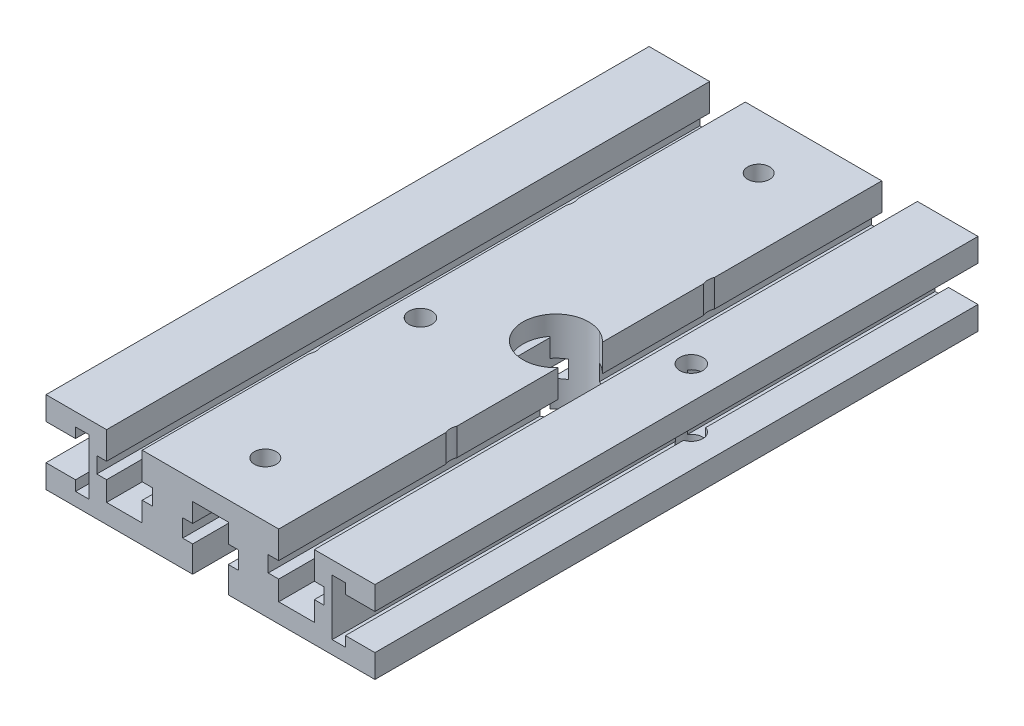
from build123d import *

# Parameters (mm, degrees)
EXTRUDE_1_DEPTH         = 110
HOLE_WIZARD_5_5_5_5_1_D = 5.5
HOLE_WIZARD_4_0_4_1_D   = 4
HOLE_WIZARD_12_0_12_1_D = 12
HOLE_WIZARD_M5_1_D      = 4.2


with BuildPart() as part:
    # 草图1 → 凸台-拉伸1 (new body)
    with BuildSketch(Plane.XY):
        Polygon((0, 0), (26.75, 0), (26.75, 4.796419132), (24.926505169, 4.796419132), (24.926505169, 8.023402897), (26.75, 8.023402897), (26.75, 11.5), (30, 11.5), (33.25, 11.5), (33.25, 8.023402897), (35.073494831, 8.023402897), (35.073494831, 4.796419132), (33.25, 4.796419132), (33.25, 0), (60, 0), (60, 4.25), (54.613325713, 4.25), (54.613325713, 2.4), (52.2, 2.4), (52.2, 12.6), (54.613325713, 12.6), (54.613325713, 10.75), (60, 10.75), (60, 15), (48.947608979, 15), (48.947608979, 10.003848618), (50.733802833, 10.003848618), (50.733802833, 7.094693738), (48.947608979, 7.094693738), (48.947608979, 3.5), (42.447608979, 3.5), (42.447608979, 7.094693738), (40.533802833, 7.094693738), (40.533802833, 10.003848618), (42.447608979, 10.003848618), (42.447608979, 15), (30, 15), (17.552391021, 15), (17.552391021, 10.003848618), (19.466197167, 10.003848618), (19.466197167, 7.094693738), (17.552391021, 7.094693738), (17.552391021, 3.5), (11.052391021, 3.5), (11.052391021, 7.094693738), (9.266197167, 7.094693738), (9.266197167, 10.003848618), (11.052391021, 10.003848618), (11.052391021, 15), (0, 15), (0, 10.75), (5.386674287, 10.75), (5.386674287, 12.6), (7.8, 12.6), (7.8, 2.4), (5.386674287, 2.4), (5.386674287, 4.25), (0, 4.25), align=None)
    extrude(amount=EXTRUDE_1_DEPTH)

    # Ø5.5 (5.5) 直径孔1 (through all)
    with Locations(Plane(origin=(0, 0, 0), x_dir=(-1, 0, 0), z_dir=(0, -1, 0))):
        with Locations((-45, -78.5), (-45, -31.5), (-15, -31.5), (-15, -78.5)):
            Hole(HOLE_WIZARD_5_5_5_5_1_D / 2)

    # Ø4.0 (4) 直径孔1 (through all)
    with Locations(Plane(origin=(0, 11.5, 0), x_dir=(-1, 0, 0), z_dir=(0, -1, 0))):
        with Locations((-30, -100), (-30, -10)):
            Hole(HOLE_WIZARD_4_0_4_1_D / 2)

    # Ø12.0 (12) 直径孔1 (through all)
    with Locations(Plane(origin=(0, 0, 0), x_dir=(-1, 0, 0), z_dir=(0, -1, 0))):
        with Locations((-38, -55)):
            Hole(HOLE_WIZARD_12_0_12_1_D / 2)

    # M5 螺纹孔1 (through all)
    with Locations(Plane(origin=(0, 0, 0), x_dir=(-1, 0, 0), z_dir=(0, -1, 0))):
        with Locations((-54, -46.3), (-22, -63.7)):
            Hole(HOLE_WIZARD_M5_1_D / 2)


solid = part.part
